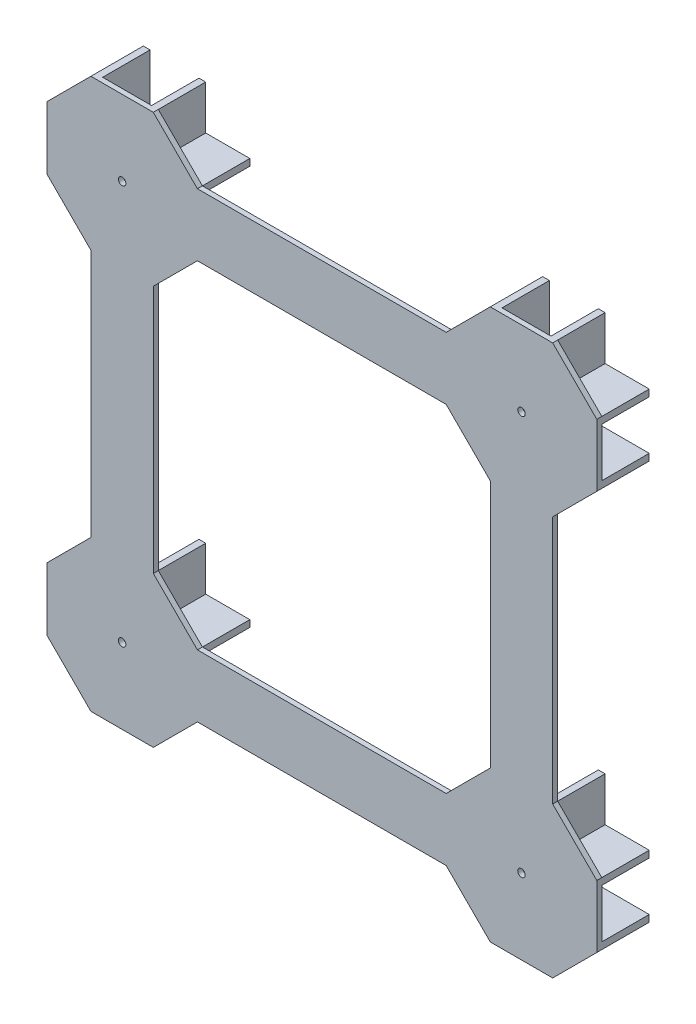
from build123d import *

# Parameters (mm, degrees)
BOSS_EXTRUDE1_DEPTH = 2
BOSS_EXTRUDE2_DEPTH = 19
SKETCH6_R           = 1.5
CUT_EXTRUDE1_DEPTH  = 221.788733523


with BuildPart() as part:
    # Sketch1 → Boss-Extrude1 (new body)
    with BuildSketch(Plane.XY):
        Polygon((12.5, -110.17766953), (-12.5, -110.17766953), (-30.17766953, -92.5), (-129.82233047, -92.5), (-147.5, -110.17766953), (-172.5, -110.17766953), (-190.17766953, -92.5), (-190.17766953, -67.5), (-172.5, -49.82233047), (-172.5, 49.82233047), (-190.17766953, 67.5), (-190.17766953, 92.5), (-172.5, 110.17766953), (-147.5, 110.17766953), (-129.82233047, 92.5), (-30.17766953, 92.5), (-12.5, 110.17766953), (12.5, 110.17766953), (30.17766953, 92.5), (30.17766953, 67.5), (12.5, 49.82233047), (12.5, -49.82233047), (30.17766953, -67.5), (30.17766953, -92.5), align=None)
        Polygon((-30.17766953, -67.5), (-12.5, -49.82233047), (-12.5, 49.82233047), (-30.17766953, 67.5), (-129.82233047, 67.5), (-147.5, 49.82233047), (-147.5, -49.82233047), (-129.82233047, -67.5), align=None, mode=Mode.SUBTRACT)
    extrude(amount=BOSS_EXTRUDE1_DEPTH)

    # Sketch2 → Boss-Extrude2 (add)
    with BuildSketch(Plane(origin=(0, 0, 0), x_dir=(-1, 0, 0), z_dir=(0, 0, -1))):
        Polygon((30.17766953, -67.5), (12.5, -67.5), (12.5, -49.82233047), (9.8, -49.82233047), (9.8, -70.2), (30.17766953, -70.2), align=None)
        Polygon((12.5, -92.5), (30.17766953, -92.5), (30.17766953, -89.8), (9.8, -89.8), (9.8, -110.17766953), (12.5, -110.17766953), align=None)
        Polygon((-12.5, -92.5), (-12.5, -110.17766953), (-9.8, -110.17766953), (-9.8, -89.8), (-30.17766953, -89.8), (-30.17766953, -92.5), align=None)
        Polygon((-12.5, -67.5), (-30.17766953, -67.5), (-30.17766953, -70.2), (-9.8, -70.2), (-9.8, -49.82233047), (-12.5, -49.82233047), align=None)
        Polygon((190.17766953, -67.5), (172.5, -67.5), (172.5, -49.82233047), (169.8, -49.82233047), (169.8, -70.2), (190.17766953, -70.2), align=None)
        Polygon((172.5, -92.5), (190.17766953, -92.5), (190.17766953, -89.8), (169.8, -89.8), (169.8, -110.17766953), (172.5, -110.17766953), align=None)
        Polygon((147.5, -92.5), (147.5, -110.17766953), (150.2, -110.17766953), (150.2, -89.8), (129.82233047, -89.8), (129.82233047, -92.5), align=None)
        Polygon((147.5, -67.5), (129.82233047, -67.5), (129.82233047, -70.2), (150.2, -70.2), (150.2, -49.82233047), (147.5, -49.82233047), align=None)
        Polygon((190.17766953, 92.5), (172.5, 92.5), (172.5, 110.17766953), (169.8, 110.17766953), (169.8, 89.8), (190.17766953, 89.8), align=None)
        Polygon((172.5, 67.5), (190.17766953, 67.5), (190.17766953, 70.2), (169.8, 70.2), (169.8, 49.82233047), (172.5, 49.82233047), align=None)
        Polygon((147.5, 67.5), (147.5, 49.82233047), (150.2, 49.82233047), (150.2, 70.2), (129.82233047, 70.2), (129.82233047, 67.5), align=None)
        Polygon((147.5, 92.5), (129.82233047, 92.5), (129.82233047, 89.8), (150.2, 89.8), (150.2, 110.17766953), (147.5, 110.17766953), align=None)
        Polygon((30.17766953, 92.5), (12.5, 92.5), (12.5, 110.17766953), (9.8, 110.17766953), (9.8, 89.8), (30.17766953, 89.8), align=None)
        Polygon((12.5, 67.5), (30.17766953, 67.5), (30.17766953, 70.2), (9.8, 70.2), (9.8, 49.82233047), (12.5, 49.82233047), align=None)
        Polygon((-12.5, 67.5), (-12.5, 49.82233047), (-9.8, 49.82233047), (-9.8, 70.2), (-30.17766953, 70.2), (-30.17766953, 67.5), align=None)
        Polygon((-12.5, 92.5), (-30.17766953, 92.5), (-30.17766953, 89.8), (-9.8, 89.8), (-9.8, 110.17766953), (-12.5, 110.17766953), align=None)
    extrude(amount=BOSS_EXTRUDE2_DEPTH)

    # Sketch6 → Cut-Extrude1 (cut, through all)
    with BuildSketch(Plane.XY.offset(2)):
        with Locations((-160, 80)):
            Circle(SKETCH6_R)
        with Locations((0, 80)):
            Circle(SKETCH6_R)
        with Locations((-160, -80)):
            Circle(SKETCH6_R)
        with Locations((0, -80)):
            Circle(SKETCH6_R)
    extrude(amount=-CUT_EXTRUDE1_DEPTH, mode=Mode.SUBTRACT)


solid = part.part
